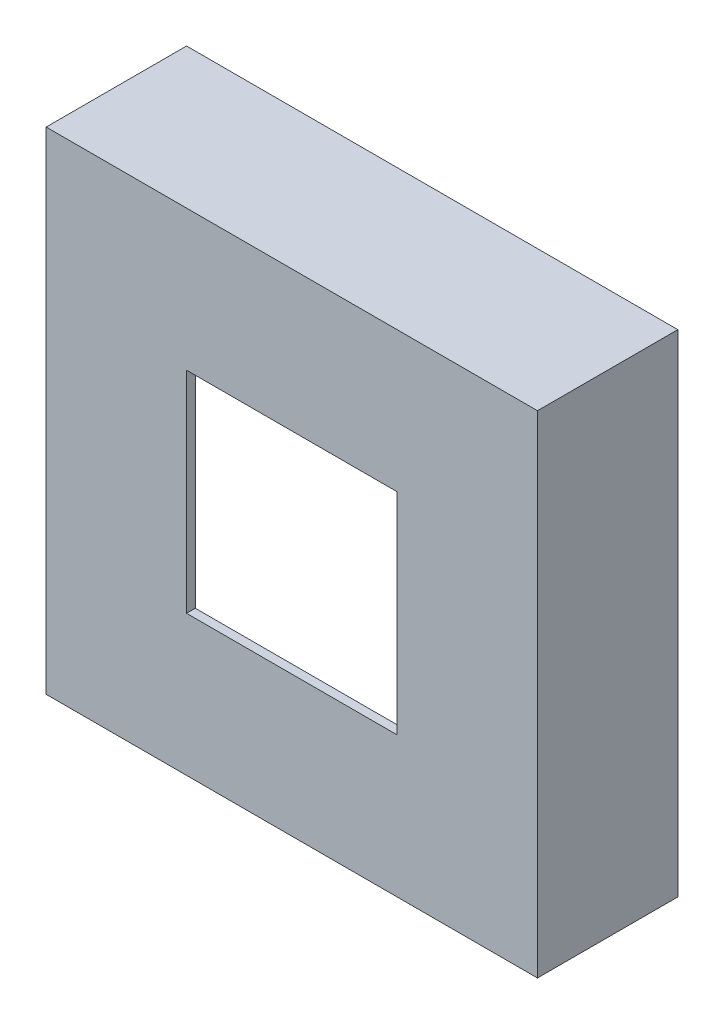
from build123d import *

# Parameters (mm, degrees)
SKETCH1_W           = 56
SKETCH1_H           = 56
SKETCH1_W_2         = 54
SKETCH1_H_2         = 54
BOSS_EXTRUDE1_DEPTH = 15
SKETCH2_W           = 56
SKETCH2_H           = 56
SKETCH2_W_2         = 24
SKETCH2_H_2         = 24
BOSS_EXTRUDE2_DEPTH = 1


with BuildPart() as part:
    # Sketch1 → Boss-Extrude1 (new body)
    with BuildSketch(Plane.XY):
        with Locations((27, 27)):
            Rectangle(SKETCH1_W, SKETCH1_H)
        with Locations((27, 27)):
            Rectangle(SKETCH1_W_2, SKETCH1_H_2, mode=Mode.SUBTRACT)
    extrude(amount=BOSS_EXTRUDE1_DEPTH)

    # Sketch2 → Boss-Extrude2 (add)
    with BuildSketch(Plane.XY.offset(15)):
        with Locations((27, 27)):
            Rectangle(SKETCH2_W, SKETCH2_H)
        with Locations((27, 27)):
            Rectangle(SKETCH2_W_2, SKETCH2_H_2, mode=Mode.SUBTRACT)
    extrude(amount=BOSS_EXTRUDE2_DEPTH)


solid = part.part
